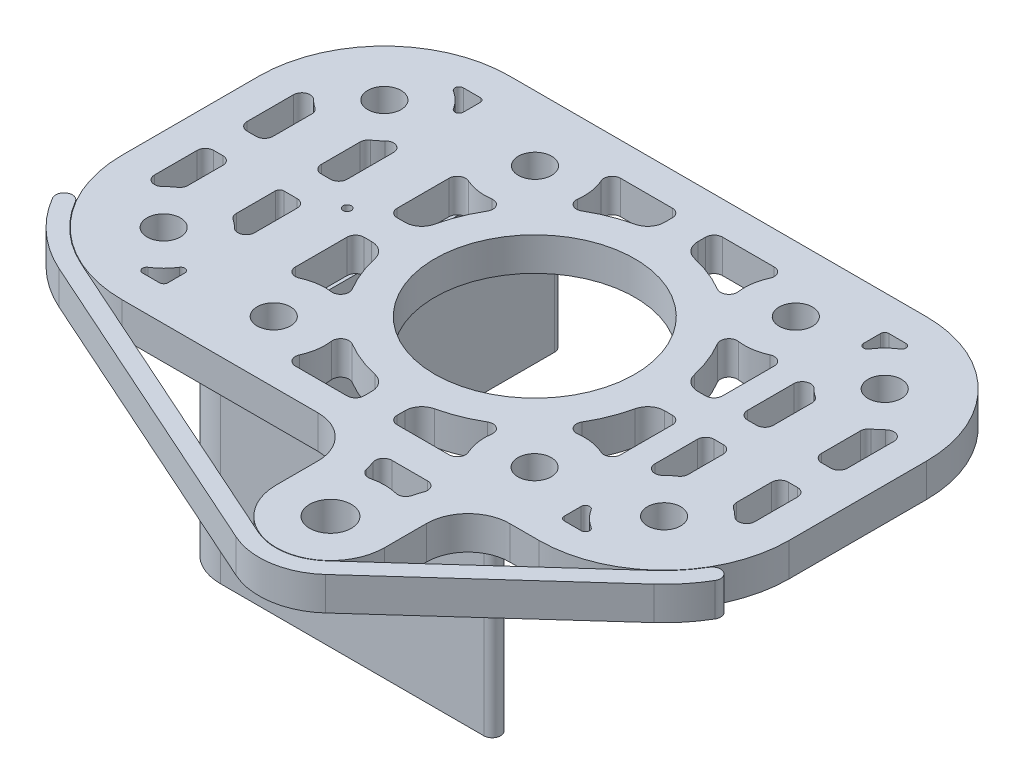
from build123d import *

# Parameters (mm, degrees)
SKETCH1_R             = 2
SKETCH1_R_2           = 12
SKETCH1_R_3           = 0.5
SKETCH1_R_4           = 2.5
BOSS_EXTRUDE1_DEPTH   = 4
BOSS_EXTRUDE1_2_DEPTH = 4
BOSS_EXTRUDE2_DEPTH   = 20
BOSS_EXTRUDE3_DEPTH   = 3


with BuildPart() as part:
    # Sketch1 → Boss-Extrude1 (new body)
    with BuildSketch(Plane(origin=(0, 0, 0), x_dir=(1, 0, 0), z_dir=(0, 1, 0))):
        with BuildLine():
            Line((-26.5, -23), (-3, -23))
            ThreePointArc((-3, -23), (0.535533906, -24.464466094), (2, -28))
            Line((2, -28), (2, -33))
            ThreePointArc((2, -33), (8.5, -39.5), (15, -33))
            Line((15, -33), (15, -28))
            ThreePointArc((15, -28), (16.464466094, -24.464466094), (20, -23))
            Line((20, -23), (23.5, -23))
            ThreePointArc((23.5, -23), (34.106601718, -18.606601718), (38.5, -8))
            Line((38.5, -8), (38.5, 8.46372283))
            ThreePointArc((38.5, 8.46372283), (34.106601718, 19.070324548), (23.5, 23.46372283))
            Line((23.5, 23.46372283), (-26.5, 23.46372283))
            ThreePointArc((-26.5, 23.46372283), (-37.106601718, 19.070324548), (-41.5, 8.46372283))
            Line((-41.5, 8.46372283), (-41.5, -8))
            ThreePointArc((-41.5, -8), (-37.106601718, -18.606601718), (-26.5, -23))
        make_face()
        with Locations(Location((-31.5, 13.46372283, 0), (0, 0, 270))):
            Circle(SKETCH1_R, mode=Mode.SUBTRACT)
        with Locations(Location((28.5, 13.46372283, 0), (0, 0, 270))):
            Circle(SKETCH1_R, mode=Mode.SUBTRACT)
        with Locations(Location((0, 0, 0), (0, 0, 270))):
            Circle(SKETCH1_R_2, mode=Mode.SUBTRACT)
        with Locations(Location((-15.637811111, 15.662146765, 0), (0, 0, 270))):
            Circle(SKETCH1_R, mode=Mode.SUBTRACT)
        with Locations(Location((15.662146765, 15.637811111, 0), (0, 0, 270))):
            Circle(SKETCH1_R, mode=Mode.SUBTRACT)
        with Locations(Location((15.637811111, -15.662146765, 0), (0, 0, 270))):
            Circle(SKETCH1_R, mode=Mode.SUBTRACT)
        with Locations(Location((-15.662146765, -15.637811111, 0), (0, 0, 270))):
            Circle(SKETCH1_R, mode=Mode.SUBTRACT)
        with Locations(Location((28.5, -13, 0), (0, 0, 270))):
            Circle(SKETCH1_R, mode=Mode.SUBTRACT)
        with Locations(Location((-31.5, -13, 0), (0, 0, 270))):
            Circle(SKETCH1_R, mode=Mode.SUBTRACT)
        with Locations(Location((-22.5, 0, 0), (0, 0, 270))):
            Circle(SKETCH1_R_3, mode=Mode.SUBTRACT)
        with Locations(Location((8.5, -33, 0), (0, 0, 270))):
            Circle(SKETCH1_R_4, mode=Mode.SUBTRACT)
        with BuildLine():
            Line((19.5, -3), (19.5, -9.206263146))
            ThreePointArc((19.5, -9.206263146), (19.041462955, -10.046987755), (18.086364264, -10.116705609))
            ThreePointArc((18.086364264, -10.116705609), (16.465532816, -9.638381302), (14.7756495, -9.624849747))
            ThreePointArc((14.7756495, -9.624849747), (13.810727907, -9.185503496), (13.78311178, -8.125627956))
            ThreePointArc((13.78311178, -8.125627956), (14.868163127, -5.910814262), (15.599936689, -3.555555556))
            ThreePointArc((15.599936689, -3.555555556), (16.302709646, -2.43652808), (17.549928775, -2))
            Line((17.549928775, -2), (18.5, -2))
            ThreePointArc((18.5, -2), (19.207106781, -2.292893219), (19.5, -3))
        make_face(mode=Mode.SUBTRACT)
        with BuildLine():
            Line((19.5, 9.206263146), (19.5, 3))
            ThreePointArc((19.5, 3), (19.207106781, 2.292893219), (18.5, 2))
            Line((18.5, 2), (17.549928775, 2))
            ThreePointArc((17.549928775, 2), (16.302709646, 2.43652808), (15.599936689, 3.555555556))
            ThreePointArc((15.599936689, 3.555555556), (14.868163127, 5.910814262), (13.78311178, 8.125627956))
            ThreePointArc((13.78311178, 8.125627956), (13.810727907, 9.185503495), (14.7756495, 9.624849747))
            ThreePointArc((14.7756495, 9.624849747), (16.465532816, 9.638381302), (18.086364264, 10.116705609))
            ThreePointArc((18.086364264, 10.116705609), (19.041462955, 10.046987755), (19.5, 9.206263146))
        make_face(mode=Mode.SUBTRACT)
        with BuildLine():
            Line((-34.4, 7.650806178), (-34.4, 3))
            ThreePointArc((-34.4, 3), (-34.692893219, 2.292893219), (-35.4, 2))
            Line((-35.4, 2), (-36.5, 2))
            ThreePointArc((-36.5, 2), (-37.207106781, 2.292893219), (-37.5, 3))
            Line((-37.5, 3), (-37.5, 8.564743344))
            ThreePointArc((-37.5, 8.564743344), (-36.877964473, 9.490563444), (-35.785714286, 9.264597557))
            ThreePointArc((-35.785714286, 9.264597557), (-35.334344076, 8.848768279), (-34.842857143, 8.481222843))
            ThreePointArc((-34.842857143, 8.481222843), (-34.517633053, 8.121368152), (-34.4, 7.650806178))
        make_face(mode=Mode.SUBTRACT)
        with BuildLine():
            Line((-28.6, 7.650806178), (-28.6, 3))
            ThreePointArc((-28.6, 3), (-28.307106781, 2.292893219), (-27.6, 2))
            Line((-27.6, 2), (-26.5, 2))
            ThreePointArc((-26.5, 2), (-25.792893219, 2.292893219), (-25.5, 3))
            Line((-25.5, 3), (-25.5, 8.564743344))
            ThreePointArc((-25.5, 8.564743344), (-26.122035527, 9.490563444), (-27.214285714, 9.264597557))
            ThreePointArc((-27.214285714, 9.264597557), (-27.665655924, 8.848768279), (-28.157142857, 8.481222843))
            ThreePointArc((-28.157142857, 8.481222843), (-28.482366947, 8.121368152), (-28.6, 7.650806178))
        make_face(mode=Mode.SUBTRACT)
        with BuildLine():
            Line((-37.5, -8.101020514), (-37.5, -3))
            ThreePointArc((-37.5, -3), (-37.207106781, -2.292893219), (-36.5, -2))
            Line((-36.5, -2), (-35.4, -2))
            ThreePointArc((-35.4, -2), (-34.692893219, -2.292893219), (-34.4, -3))
            Line((-34.4, -3), (-34.4, -7.187083348))
            ThreePointArc((-34.4, -7.187083348), (-34.517633053, -7.657645322), (-34.842857143, -8.017500013))
            ThreePointArc((-34.842857143, -8.017500013), (-35.334344076, -8.385045449), (-35.785714286, -8.800874727))
            ThreePointArc((-35.785714286, -8.800874727), (-36.877964473, -9.026840614), (-37.5, -8.101020514))
        make_face(mode=Mode.SUBTRACT)
        with BuildLine():
            Line((-3, -19.5), (-9.206263146, -19.5))
            ThreePointArc((-9.206263146, -19.5), (-10.046987755, -19.041462955), (-10.116705609, -18.086364264))
            ThreePointArc((-10.116705609, -18.086364264), (-9.638381302, -16.465532816), (-9.624849747, -14.7756495))
            ThreePointArc((-9.624849747, -14.7756495), (-9.185503496, -13.810727907), (-8.125627956, -13.78311178))
            ThreePointArc((-8.125627956, -13.78311178), (-5.910814262, -14.868163127), (-3.555555556, -15.599936689))
            ThreePointArc((-3.555555556, -15.599936689), (-2.43652808, -16.302709646), (-2, -17.549928775))
            Line((-2, -17.549928775), (-2, -18.5))
            ThreePointArc((-2, -18.5), (-2.292893219, -19.207106781), (-3, -19.5))
        make_face(mode=Mode.SUBTRACT)
        with BuildLine():
            Line((9.206263146, -19.5), (3, -19.5))
            ThreePointArc((3, -19.5), (2.292893219, -19.207106781), (2, -18.5))
            Line((2, -18.5), (2, -17.549928775))
            ThreePointArc((2, -17.549928775), (2.43652808, -16.302709646), (3.555555556, -15.599936689))
            ThreePointArc((3.555555556, -15.599936689), (5.910814262, -14.868163127), (8.125627956, -13.78311178))
            ThreePointArc((8.125627956, -13.78311178), (9.185503495, -13.810727907), (9.624849747, -14.7756495))
            ThreePointArc((9.624849747, -14.7756495), (9.638381302, -16.465532816), (10.116705609, -18.086364264))
            ThreePointArc((10.116705609, -18.086364264), (10.046987755, -19.041462955), (9.206263146, -19.5))
        make_face(mode=Mode.SUBTRACT)
        with BuildLine():
            Line((-19.5, 3), (-19.5, 9.206263146))
            ThreePointArc((-19.5, 9.206263146), (-19.041462955, 10.046987755), (-18.086364264, 10.116705609))
            ThreePointArc((-18.086364264, 10.116705609), (-16.465532816, 9.638381302), (-14.7756495, 9.624849747))
            ThreePointArc((-14.7756495, 9.624849747), (-13.810727907, 9.185503496), (-13.78311178, 8.125627956))
            ThreePointArc((-13.78311178, 8.125627956), (-14.868163127, 5.910814262), (-15.599936689, 3.555555556))
            ThreePointArc((-15.599936689, 3.555555556), (-16.302709646, 2.43652808), (-17.549928775, 2))
            Line((-17.549928775, 2), (-18.5, 2))
            ThreePointArc((-18.5, 2), (-19.207106781, 2.292893219), (-19.5, 3))
        make_face(mode=Mode.SUBTRACT)
        with BuildLine():
            Line((-19.5, -9.206263146), (-19.5, -3))
            ThreePointArc((-19.5, -3), (-19.207106781, -2.292893219), (-18.5, -2))
            Line((-18.5, -2), (-17.549928775, -2))
            ThreePointArc((-17.549928775, -2), (-16.302709646, -2.43652808), (-15.599936689, -3.555555556))
            ThreePointArc((-15.599936689, -3.555555556), (-14.868163127, -5.910814262), (-13.78311178, -8.125627956))
            ThreePointArc((-13.78311178, -8.125627956), (-13.810727907, -9.185503495), (-14.7756495, -9.624849747))
            ThreePointArc((-14.7756495, -9.624849747), (-16.465532816, -9.638381302), (-18.086364264, -10.116705609))
            ThreePointArc((-18.086364264, -10.116705609), (-19.041462955, -10.046987755), (-19.5, -9.206263146))
        make_face(mode=Mode.SUBTRACT)
        with BuildLine():
            Line((-9.206263146, 19.5), (-3, 19.5))
            ThreePointArc((-3, 19.5), (-2.292893219, 19.207106781), (-2, 18.5))
            Line((-2, 18.5), (-2, 17.549928775))
            ThreePointArc((-2, 17.549928775), (-2.43652808, 16.302709646), (-3.555555556, 15.599936689))
            ThreePointArc((-3.555555556, 15.599936689), (-5.910814262, 14.868163127), (-8.125627956, 13.78311178))
            ThreePointArc((-8.125627956, 13.78311178), (-9.185503495, 13.810727907), (-9.624849747, 14.7756495))
            ThreePointArc((-9.624849747, 14.7756495), (-9.638381302, 16.465532816), (-10.116705609, 18.086364264))
            ThreePointArc((-10.116705609, 18.086364264), (-10.046987755, 19.041462955), (-9.206263146, 19.5))
        make_face(mode=Mode.SUBTRACT)
        with BuildLine():
            Line((-25.5, 16.927824445), (-25.5, 18.96372283))
            ThreePointArc((-25.5, 18.96372283), (-25.64644661, 19.317276221), (-26, 19.46372283))
            Line((-26, 19.46372283), (-28.035898385, 19.46372283))
            ThreePointArc((-28.035898385, 19.46372283), (-28.516282846, 19.102397879), (-28.30236774, 18.540645907))
            ThreePointArc((-28.30236774, 18.540645907), (-27.257359313, 17.706363517), (-26.423076923, 16.66135509))
            ThreePointArc((-26.423076923, 16.66135509), (-25.861324951, 16.447439984), (-25.5, 16.927824445))
        make_face(mode=Mode.SUBTRACT)
        with BuildLine():
            Line((2, 18.5), (2, 17.549928775))
            ThreePointArc((2, 17.549928775), (2.43652808, 16.302709646), (3.555555556, 15.599936689))
            ThreePointArc((3.555555556, 15.599936689), (5.910814262, 14.868163127), (8.125627956, 13.78311178))
            ThreePointArc((8.125627956, 13.78311178), (9.185503496, 13.810727907), (9.624849747, 14.7756495))
            ThreePointArc((9.624849747, 14.7756495), (9.638381302, 16.465532816), (10.116705609, 18.086364264))
            ThreePointArc((10.116705609, 18.086364264), (10.046987755, 19.041462955), (9.206263146, 19.5))
            Line((9.206263146, 19.5), (3, 19.5))
            ThreePointArc((3, 19.5), (2.292893219, 19.207106781), (2, 18.5))
        make_face(mode=Mode.SUBTRACT)
        with BuildLine():
            Line((-26.5, -2), (-28.1, -2))
            ThreePointArc((-28.1, -2), (-28.453553391, -2.146446609), (-28.6, -2.5))
            Line((-28.6, -2.5), (-28.6, -7.187083348))
            ThreePointArc((-28.6, -7.187083348), (-28.482366947, -7.657645322), (-28.157142857, -8.017500013))
            ThreePointArc((-28.157142857, -8.017500013), (-27.665655924, -8.385045449), (-27.214285714, -8.800874727))
            ThreePointArc((-27.214285714, -8.800874727), (-26.122035527, -9.026840614), (-25.5, -8.101020514))
            Line((-25.5, -8.101020514), (-25.5, -3))
            ThreePointArc((-25.5, -3), (-25.792893219, -2.292893219), (-26.5, -2))
        make_face(mode=Mode.SUBTRACT)
        with BuildLine():
            Line((-25.5, -16.464101615), (-25.5, -18.5))
            ThreePointArc((-25.5, -18.5), (-25.64644661, -18.853553391), (-26, -19))
            Line((-26, -19), (-28.035898385, -19))
            ThreePointArc((-28.035898385, -19), (-28.516282846, -18.638675049), (-28.30236774, -18.076923077))
            ThreePointArc((-28.30236774, -18.076923077), (-27.257359313, -17.242640687), (-26.423076923, -16.19763226))
            ThreePointArc((-26.423076923, -16.19763226), (-25.861324951, -15.983717154), (-25.5, -16.464101615))
        make_face(mode=Mode.SUBTRACT)
        with BuildLine():
            Line((23, -19.46372283), (25.035898385, -19.46372283))
            ThreePointArc((25.035898385, -19.46372283), (25.516282846, -19.102397879), (25.30236774, -18.540645907))
            ThreePointArc((25.30236774, -18.540645907), (24.257359313, -17.706363517), (23.423076923, -16.66135509))
            ThreePointArc((23.423076923, -16.66135509), (22.861324951, -16.447439984), (22.5, -16.927824445))
            Line((22.5, -16.927824445), (22.5, -18.96372283))
            ThreePointArc((22.5, -18.96372283), (22.646446609, -19.317276221), (23, -19.46372283))
        make_face(mode=Mode.SUBTRACT)
        with BuildLine():
            Line((22.5, -8.101020514), (22.5, -3))
            ThreePointArc((22.5, -3), (22.792893219, -2.292893219), (23.5, -2))
            Line((23.5, -2), (24.6, -2))
            ThreePointArc((24.6, -2), (25.307106781, -2.292893219), (25.6, -3))
            Line((25.6, -3), (25.6, -7.187083348))
            ThreePointArc((25.6, -7.187083348), (25.482366947, -7.657645322), (25.157142857, -8.017500013))
            ThreePointArc((25.157142857, -8.017500013), (24.665655924, -8.385045449), (24.214285714, -8.800874727))
            ThreePointArc((24.214285714, -8.800874727), (23.122035527, -9.026840614), (22.5, -8.101020514))
        make_face(mode=Mode.SUBTRACT)
        with BuildLine():
            Line((22.5, 16.927824445), (22.5, 18.96372283))
            ThreePointArc((22.5, 18.96372283), (22.646446609, 19.317276221), (23, 19.46372283))
            Line((23, 19.46372283), (25.035898385, 19.46372283))
            ThreePointArc((25.035898385, 19.46372283), (25.516282846, 19.102397879), (25.30236774, 18.540645907))
            ThreePointArc((25.30236774, 18.540645907), (24.257359313, 17.706363517), (23.423076923, 16.66135509))
            ThreePointArc((23.423076923, 16.66135509), (22.861324951, 16.447439984), (22.5, 16.927824445))
        make_face(mode=Mode.SUBTRACT)
        with BuildLine():
            Line((34.5, -8.101020514), (34.5, -3))
            ThreePointArc((34.5, -3), (34.207106781, -2.292893219), (33.5, -2))
            Line((33.5, -2), (32.4, -2))
            ThreePointArc((32.4, -2), (31.692893219, -2.292893219), (31.4, -3))
            Line((31.4, -3), (31.4, -7.187083348))
            ThreePointArc((31.4, -7.187083348), (31.517633053, -7.657645322), (31.842857143, -8.017500013))
            ThreePointArc((31.842857143, -8.017500013), (32.334344076, -8.385045449), (32.785714286, -8.800874727))
            ThreePointArc((32.785714286, -8.800874727), (33.877964473, -9.026840614), (34.5, -8.101020514))
        make_face(mode=Mode.SUBTRACT)
        with BuildLine():
            Line((25.6, 7.650806178), (25.6, 3))
            ThreePointArc((25.6, 3), (25.307106781, 2.292893219), (24.6, 2))
            Line((24.6, 2), (23.5, 2))
            ThreePointArc((23.5, 2), (22.792893219, 2.292893219), (22.5, 3))
            Line((22.5, 3), (22.5, 8.564743344))
            ThreePointArc((22.5, 8.564743344), (23.122035527, 9.490563444), (24.214285714, 9.264597557))
            ThreePointArc((24.214285714, 9.264597557), (24.665655924, 8.848768279), (25.157142857, 8.481222843))
            ThreePointArc((25.157142857, 8.481222843), (25.482366947, 8.121368152), (25.6, 7.650806178))
        make_face(mode=Mode.SUBTRACT)
        with BuildLine():
            Line((31.4, 7.650806178), (31.4, 3))
            ThreePointArc((31.4, 3), (31.692893219, 2.292893219), (32.4, 2))
            Line((32.4, 2), (33.5, 2))
            ThreePointArc((33.5, 2), (34.207106781, 2.292893219), (34.5, 3))
            Line((34.5, 3), (34.5, 8.564743344))
            ThreePointArc((34.5, 8.564743344), (33.877964473, 9.490563444), (32.785714286, 9.264597557))
            ThreePointArc((32.785714286, 9.264597557), (32.334344076, 8.848768279), (31.842857143, 8.481222843))
            ThreePointArc((31.842857143, 8.481222843), (31.517633053, 8.121368152), (31.4, 7.650806178))
        make_face(mode=Mode.SUBTRACT)
        with BuildLine():
            Line((10.632503002, -23.5), (6.367496998, -23.5))
            ThreePointArc((6.367496998, -23.5), (5.545913161, -23.929912287), (5.430747298, -24.85))
            ThreePointArc((5.430747298, -24.85), (5.613124693, -25.389620139), (5.761001589, -25.939696345))
            ThreePointArc((5.761001589, -25.939696345), (6.210826608, -26.562725893), (6.969853382, -26.682670554))
            ThreePointArc((6.969853382, -26.682670554), (8.5, -26.5), (10.030146618, -26.682670554))
            ThreePointArc((10.030146618, -26.682670554), (10.789173392, -26.562725893), (11.238998411, -25.939696345))
            ThreePointArc((11.238998411, -25.939696345), (11.386875307, -25.389620139), (11.569252702, -24.85))
            ThreePointArc((11.569252702, -24.85), (11.454086839, -23.929912287), (10.632503002, -23.5))
        make_face(mode=Mode.SUBTRACT)
    extrude(amount=BOSS_EXTRUDE1_DEPTH)

    # Sketch2 → Boss-Extrude2 (add)
    with BuildSketch(Plane(origin=(0, 0, 0), x_dir=(1, 0, 0), z_dir=(0, 1, 0))):
        with BuildLine():
            Line((-21.1, 21.46372283), (-21.1, -16.6))
            ThreePointArc((-21.1, -16.6), (-19.342640687, -20.842640687), (-15.1, -22.6))
            Line((-15.1, -22.6), (16.499327399, -22.6))
            ThreePointArc((16.499327399, -22.6), (17.499327399, -21.6), (16.499327399, -20.6))
            Line((16.499327399, -20.6), (-15.1, -20.6))
            ThreePointArc((-15.1, -20.6), (-17.928427125, -19.428427125), (-19.1, -16.6))
            Line((-19.1, -16.6), (-19.1, 21.46372283))
            ThreePointArc((-19.1, 21.46372283), (-20.1, 22.46372283), (-21.1, 21.46372283))
        make_face()
    extrude(amount=-BOSS_EXTRUDE2_DEPTH)

    # Sketch3 → Boss-Extrude3 (add)
    # profile 1 of 2: a face of its own
    with BuildSketch(Plane(origin=(0, 0, 0), x_dir=(1, 0, 0), z_dir=(0, 1, 0))):
        with BuildLine():
            Line((31.4, 5.56372283), (31.4, -5.1))
            ThreePointArc((31.4, -5.1), (28.5, -8), (25.6, -5.1))
            Line((25.6, -5.1), (25.6, 5.56372283))
            ThreePointArc((25.6, 5.56372283), (28.5, 8.46372283), (31.4, 5.56372283))
        make_face()
        with BuildLine():
            Line((27.6, 5.56372283), (27.6, -5.1))
            ThreePointArc((27.6, -5.1), (28.5, -6), (29.4, -5.1))
            Line((29.4, -5.1), (29.4, 5.56372283))
            ThreePointArc((29.4, 5.56372283), (28.5, 6.46372283), (27.6, 5.56372283))
        make_face(mode=Mode.SUBTRACT)
    # profile 2 of 2: a face of its own
    with BuildSketch(Plane(origin=(0, 0, 0), x_dir=(1, 0, 0), z_dir=(0, 1, 0))):
        with BuildLine():
            Line((-28.6, -5.1), (-28.6, 5.56372283))
            ThreePointArc((-28.6, 5.56372283), (-31.5, 8.46372283), (-34.4, 5.56372283))
            Line((-34.4, 5.56372283), (-34.4, -5.1))
            ThreePointArc((-34.4, -5.1), (-31.5, -8), (-28.6, -5.1))
        make_face()
        with BuildLine():
            Line((-32.4, -5.1), (-32.4, 5.56372283))
            ThreePointArc((-32.4, 5.56372283), (-31.5, 6.46372283), (-30.6, 5.56372283))
            Line((-30.6, 5.56372283), (-30.6, -5.1))
            ThreePointArc((-30.6, -5.1), (-31.5, -6), (-32.4, -5.1))
        make_face(mode=Mode.SUBTRACT)
    extrude(amount=-BOSS_EXTRUDE3_DEPTH)


with BuildPart() as body_2:
    # Sketch1 → Boss-Extrude1 2 (new body)
    with BuildSketch(Plane(origin=(0, 0, 0), x_dir=(1, 0, 0), z_dir=(0, 1, 0))):
        with BuildLine():
            Line((12.890073837, -37.861044302), (33.58711622, -19.169269732))
            ThreePointArc((33.58711622, -19.169269732), (35.181994447, -17.488598724), (36.5, -15.583040287))
            ThreePointArc((36.5, -15.583040287), (37.867643873, -15.223109409), (38.227574751, -16.590753282))
            ThreePointArc((38.227574751, -16.590753282), (36.734418958, -18.749542076), (34.927596781, -20.653558069))
            Line((34.927596781, -20.653558069), (14.230554398, -39.345332639))
            ThreePointArc((14.230554398, -39.345332639), (9.833521023, -41.445366877), (5.003353556, -40.802305021))
            Line((5.003353556, -40.802305021), (-33.472844663, -23.558982528))
            ThreePointArc((-33.472844663, -23.558982528), (-37.895881071, -20.682128946), (-41.227574751, -16.590753283))
            ThreePointArc((-41.227574751, -16.590753283), (-40.867643873, -15.22310941), (-39.5, -15.583040288))
            ThreePointArc((-39.5, -15.583040288), (-36.559120828, -19.194489187), (-32.65491567, -21.733881938))
            Line((-32.65491567, -21.733881938), (5.821282549, -38.977204432))
            ThreePointArc((5.821282549, -38.977204432), (9.52158628, -39.469842461), (12.890073837, -37.861044302))
        make_face()
    extrude(amount=BOSS_EXTRUDE1_2_DEPTH)


solid = Compound([part.part, body_2.part])
